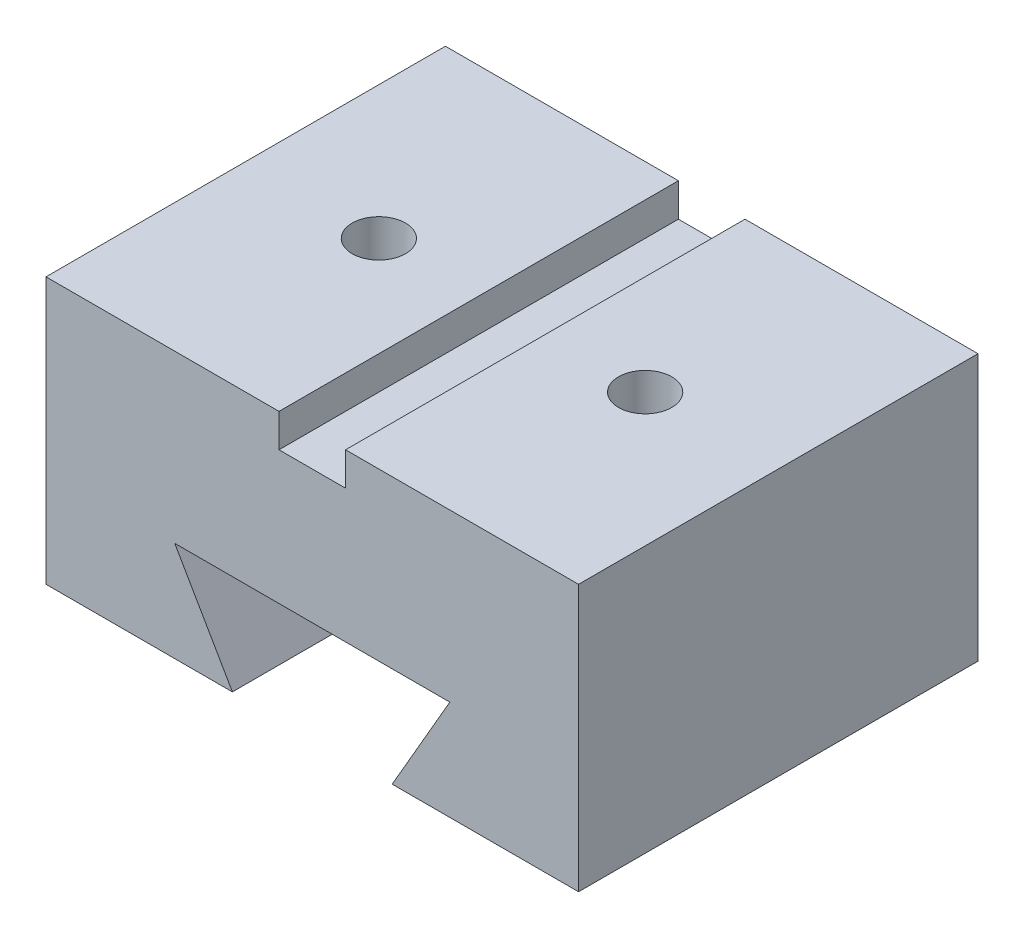
from build123d import *

# Parameters (mm, degrees)
SKETCH_1_W          = 80
SKETCH_1_H          = 60
EXTRUDE_1_DEPTH     = 40
CUT_EXTRUDE_1_DEPTH = 65.031242374
CUT_EXTRUDE_2_DEPTH = 65.031242374
SKETCH_4_W          = 10
SKETCH_4_H          = 60
CUT_EXTRUDE_3_DEPTH = 5
SKETCH_5_R          = 4
CUT_EXTRUDE_4_DEPTH = 12


with BuildPart() as part:
    # 草图1 → 凸台-拉伸1 (new body)
    with BuildSketch(Plane(origin=(0, 0, 0), x_dir=(1, 0, 0), z_dir=(0, 1, 0))):
        Rectangle(SKETCH_1_W, SKETCH_1_H)
    extrude(amount=EXTRUDE_1_DEPTH)

    # 草图2 → 切除-拉伸1 (cut, through all)
    with BuildSketch(Plane.XY):
        Polygon((-12, 0), (12, 0), (20.6603, 15), (-20.6603, 15), align=None)
    extrude(amount=CUT_EXTRUDE_1_DEPTH, mode=Mode.SUBTRACT)

    # 草图3 → 切除-拉伸2 (cut, through all)
    with BuildSketch(Plane.XY):
        Polygon((-12, 0), (12, 0), (20.6603, 15), (-20.6603, 15), align=None)
    extrude(amount=-CUT_EXTRUDE_2_DEPTH, mode=Mode.SUBTRACT)

    # 草图4 → 切除-拉伸3 (cut)
    with BuildSketch(Plane(origin=(0, 40, 0), x_dir=(1, 0, 0), z_dir=(0, 1, 0))):
        Rectangle(SKETCH_4_W, SKETCH_4_H)
    extrude(amount=-CUT_EXTRUDE_3_DEPTH, mode=Mode.SUBTRACT)

    # 草图5 → 切除-拉伸4 (cut)
    with BuildSketch(Plane(origin=(0, 40, 0), x_dir=(1, 0, 0), z_dir=(0, 1, 0))):
        with Locations(Location((-20, 0, 0), (0, 0, 270))):
            Circle(SKETCH_5_R)
        with Locations(Location((20, 0, 0), (0, 0, 270))):
            Circle(SKETCH_5_R)
    extrude(amount=-CUT_EXTRUDE_4_DEPTH, mode=Mode.SUBTRACT)


solid = part.part
